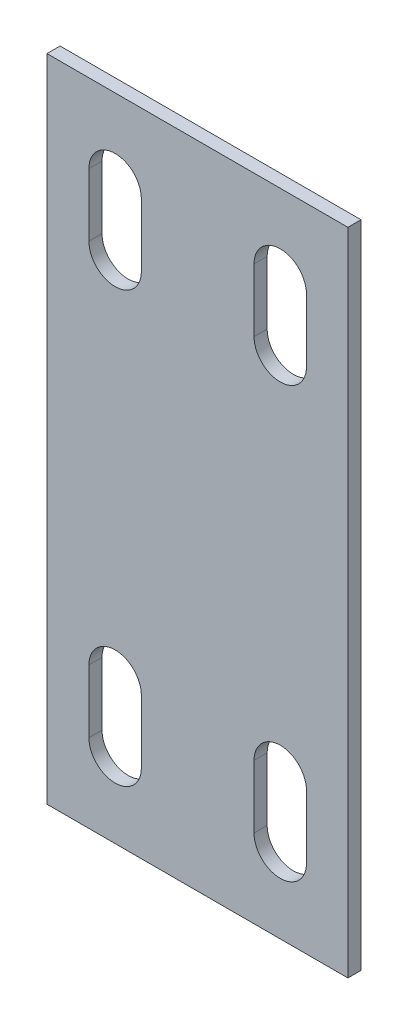
from build123d import *

# Parameters (mm, degrees)
FLAT_PLATE_W       = 72.898
FLAT_PLATE_H       = 157.48
CASTOR_PLATE_DEPTH = 3.175
CUT_EXTRUDE1_DEPTH = 3.175


with BuildPart() as part:
    # Flat Plate → Castor Plate (new body)
    with BuildSketch(Plane.XY):
        with Locations((-64.932085316, 2.634948054)):
            Rectangle(FLAT_PLATE_W, FLAT_PLATE_H)
    extrude(amount=CASTOR_PLATE_DEPTH)

    # Holes → Cut-Extrude1 (cut)
    with BuildSketch(Plane.XY.offset(3.175)):
        with BuildLine():
            Line((-91.221085316, 47.084948054), (-91.221085316, 62.324948422))
            ThreePointArc((-91.221085316, 62.324948422), (-84.871085684, 68.674948054), (-78.521086052, 62.324948422))
            Line((-78.521086052, 62.324948422), (-78.521086052, 47.084948054))
            ThreePointArc((-78.521086052, 47.084948054), (-84.871085684, 40.734948422), (-91.221085316, 47.084948054))
        make_face()
        with BuildLine():
            Line((-51.221165316, -57.055051578), (-51.221165316, -41.81505121))
            ThreePointArc((-51.221165316, -41.81505121), (-44.871165684, -35.465051578), (-38.521166052, -41.81505121))
            Line((-38.521166052, -41.81505121), (-38.521166052, -57.055051578))
            ThreePointArc((-38.521166052, -57.055051578), (-44.871165684, -63.40505121), (-51.221165316, -57.055051578))
        make_face()
        with BuildLine():
            Line((-78.521086052, -41.81505121), (-78.521086052, -57.055051578))
            ThreePointArc((-78.521086052, -57.055051578), (-84.871085684, -63.40505121), (-91.221085316, -57.055051578))
            Line((-91.221085316, -57.055051578), (-91.221085316, -41.81505121))
            ThreePointArc((-91.221085316, -41.81505121), (-84.871085684, -35.465051578), (-78.521086052, -41.81505121))
        make_face()
        with BuildLine():
            Line((-38.521166052, 62.324948422), (-38.521166052, 47.084948054))
            ThreePointArc((-38.521166052, 47.084948054), (-44.871165684, 40.734948422), (-51.221165316, 47.084948054))
            Line((-51.221165316, 47.084948054), (-51.221165316, 62.324948422))
            ThreePointArc((-51.221165316, 62.324948422), (-44.871165684, 68.674948054), (-38.521166052, 62.324948422))
        make_face()
    extrude(amount=-CUT_EXTRUDE1_DEPTH, mode=Mode.SUBTRACT)


solid = part.part
